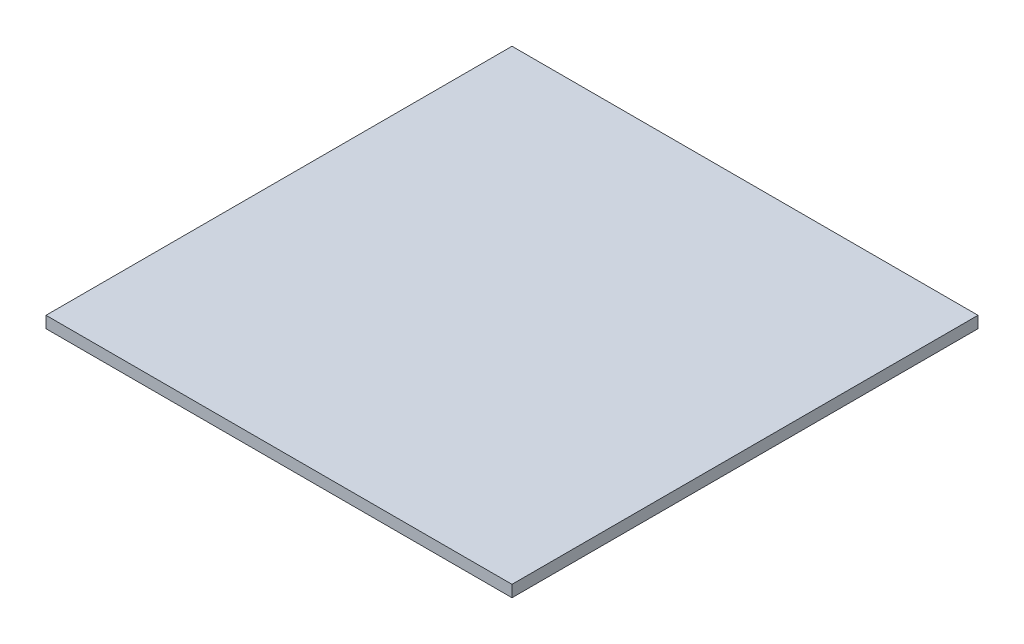
from build123d import *

# Parameters (mm, degrees)
ESBO_O1_W                = 600
ESBO_O1_H                = 600
RESSALTO_EXTRUS_O1_DEPTH = 15


with BuildPart() as part:
    # Esboço1 → Ressalto-extrusão1 (new body)
    with BuildSketch(Plane(origin=(0, 0, 0), x_dir=(1, 0, 0), z_dir=(0, 1, 0))):
        Rectangle(ESBO_O1_W, ESBO_O1_H)
    extrude(amount=RESSALTO_EXTRUS_O1_DEPTH)


solid = part.part
